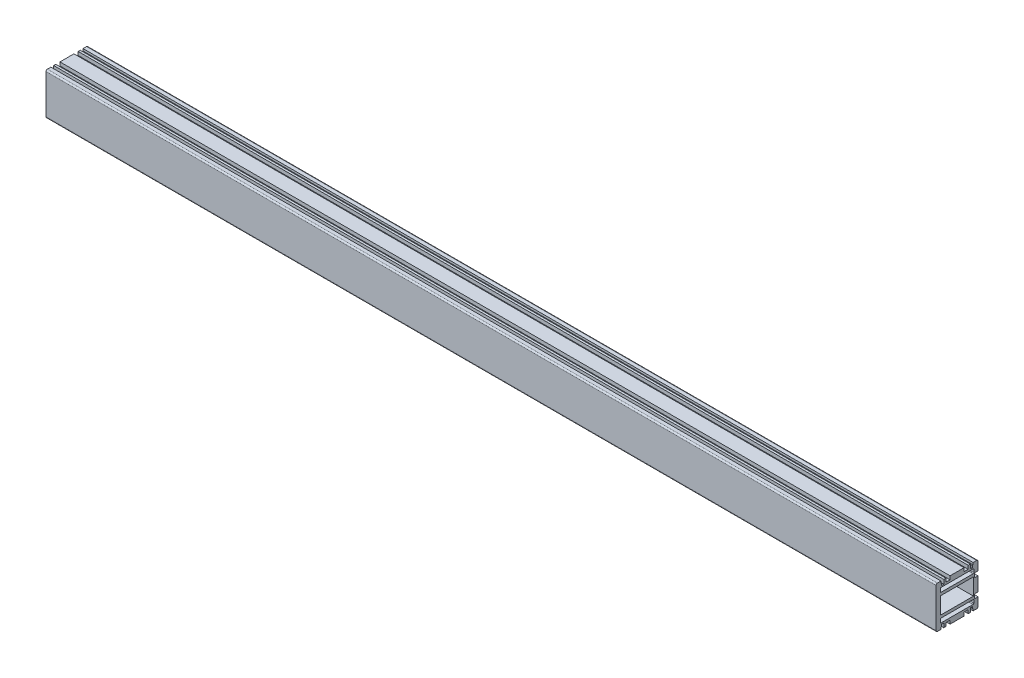
from build123d import *

# Parameters (mm, degrees)
SKETCH_1_W             = 23.5
SKETCH_1_H             = 12
EXTRUDE_1_DEPTH        = 318.5
HOLE_WIZARD_M6_1_D     = 5
HOLE_WIZARD_M6_1_DEPTH = 15
HOLE_WIZARD_M6_1_TIP   = 1.502151548
HOLE_WIZARD_M6_2_D     = 5
HOLE_WIZARD_M6_2_DEPTH = 15
HOLE_WIZARD_M6_2_TIP   = 1.502151548
HOLE_WIZARD_M4_1_D     = 3.3
HOLE_WIZARD_M4_1_DEPTH = 10.1
HOLE_WIZARD_M4_1_TIP   = 0.991420021


with BuildPart() as part:
    # 草图1 → 凸台-拉伸1 (new, symmetric)
    with BuildSketch(Plane(origin=(0, 0, 0), x_dir=(0, 0, -1), z_dir=(1, 0, 0))):
        with BuildLine():
            Line((-14, 15), (-11.5, 15))
            Line((-11.5, 15), (-11.5, 13.5))
            Line((-11.5, 13.5), (-11.4, 13.5))
            ThreePointArc((-11.4, 13.5), (-11.117157288, 13.382842712), (-11, 13.1))
            Line((-11, 13.1), (-11, 12))
            Line((-11, 12), (-9.5, 12))
            Line((-9.5, 12), (-9.5, 15))
            Line((-9.5, 15), (-8, 15))
            Line((-8, 15), (-8, 12.5))
            Line((-8, 12.5), (-5, 12.5))
            Line((-5, 12.5), (-5, 15))
            Line((-5, 15), (5, 15))
            Line((5, 15), (5, 12.5))
            Line((5, 12.5), (8, 12.5))
            Line((8, 12.5), (8, 15))
            Line((8, 15), (9.5, 15))
            Line((9.5, 15), (9.5, 12))
            Line((9.5, 12), (11, 12))
            Line((11, 12), (11, 13.1))
            ThreePointArc((11, 13.1), (11.117157288, 13.382842712), (11.4, 13.5))
            Line((11.4, 13.5), (11.5, 13.5))
            Line((11.5, 13.5), (11.5, 15))
            Line((11.5, 15), (14, 15))
            ThreePointArc((14, 15), (14.707106781, 14.707106781), (15, 14))
            Line((15, 14), (15, 8))
            Line((15, 8), (12.5, 8))
            Line((12.5, 8), (12.5, 5))
            Line((12.5, 5), (15, 5))
            Line((15, 5), (15, -5))
            Line((15, -5), (12.5, -5))
            Line((12.5, -5), (12.5, -8))
            Line((12.5, -8), (15, -8))
            Line((15, -8), (15, -14))
            ThreePointArc((15, -14), (14.707106781, -14.707106781), (14, -15))
            Line((14, -15), (11.5, -15))
            Line((11.5, -15), (11.5, -13.5))
            Line((11.5, -13.5), (11.4, -13.5))
            ThreePointArc((11.4, -13.5), (11.117157288, -13.382842712), (11, -13.1))
            Line((11, -13.1), (11, -12))
            Line((11, -12), (9.5, -12))
            Line((9.5, -12), (9.5, -15))
            Line((9.5, -15), (8, -15))
            Line((8, -15), (8, -12.5))
            Line((8, -12.5), (5, -12.5))
            Line((5, -12.5), (5, -15))
            Line((5, -15), (-5, -15))
            Line((-5, -15), (-5, -12.5))
            Line((-5, -12.5), (-8, -12.5))
            Line((-8, -12.5), (-8, -15))
            Line((-8, -15), (-9.5, -15))
            Line((-9.5, -15), (-9.5, -12))
            Line((-9.5, -12), (-11, -12))
            Line((-11, -12), (-11, -13.1))
            ThreePointArc((-11, -13.1), (-11.117157288, -13.382842712), (-11.4, -13.5))
            Line((-11.4, -13.5), (-11.5, -13.5))
            Line((-11.5, -13.5), (-11.5, -15))
            Line((-11.5, -15), (-14, -15))
            ThreePointArc((-14, -15), (-14.707106781, -14.707106781), (-15, -14))
            Line((-15, -14), (-15, 14))
            ThreePointArc((-15, 14), (-14.707106781, 14.707106781), (-14, 15))
        make_face()
        with BuildLine():
            Line((12, -10.5), (12, -8.5))
            ThreePointArc((12, -8.5), (11.853553391, -8.146446609), (11.5, -8))
            Line((11.5, -8), (-11.5, -8))
            ThreePointArc((-11.5, -8), (-11.853553391, -8.146446609), (-12, -8.5))
            Line((-12, -8.5), (-12, -10.5))
            ThreePointArc((-12, -10.5), (-11.853553391, -10.853553391), (-11.5, -11))
            Line((-11.5, -11), (11.5, -11))
            ThreePointArc((11.5, -11), (11.853553391, -10.853553391), (12, -10.5))
        make_face(mode=Mode.SUBTRACT)
        with BuildLine():
            Line((-11.5, 11), (11.5, 11))
            ThreePointArc((11.5, 11), (11.853553391, 10.853553391), (12, 10.5))
            Line((12, 10.5), (12, 8.5))
            ThreePointArc((12, 8.5), (11.853553391, 8.146446609), (11.5, 8))
            Line((11.5, 8), (-11.5, 8))
            ThreePointArc((-11.5, 8), (-11.853553391, 8.146446609), (-12, 8.5))
            Line((-12, 8.5), (-12, 10.5))
            ThreePointArc((-12, 10.5), (-11.853553391, 10.853553391), (-11.5, 11))
        make_face(mode=Mode.SUBTRACT)
        Rectangle(SKETCH_1_W, SKETCH_1_H, mode=Mode.SUBTRACT)
    extrude(amount=EXTRUDE_1_DEPTH, both=True)

    # M6 螺纹孔1
    with Locations(Plane(origin=(0, 0, -15), x_dir=(-1, 0, 0), z_dir=(0, 0, -1))):
        with Locations((298.5, -0.143680977), (283.5, 0)):
            Hole(HOLE_WIZARD_M6_1_D / 2, depth=HOLE_WIZARD_M6_1_DEPTH)
            with Locations((0, 0, -(HOLE_WIZARD_M6_1_DEPTH + HOLE_WIZARD_M6_1_TIP / 2))):  # 118° drill point
                Cone(0, HOLE_WIZARD_M6_1_D / 2, HOLE_WIZARD_M6_1_TIP, mode=Mode.SUBTRACT)

    # M6 螺纹孔2
    with Locations(Plane.XZ.offset(15)):
        with Locations((-298.5, 0), (-283.5, 0), (283.5, 0), (298.5, 0)):
            Hole(HOLE_WIZARD_M6_2_D / 2, depth=HOLE_WIZARD_M6_2_DEPTH)
            with Locations((0, 0, -(HOLE_WIZARD_M6_2_DEPTH + HOLE_WIZARD_M6_2_TIP / 2))):  # 118° drill point
                Cone(0, HOLE_WIZARD_M6_2_D / 2, HOLE_WIZARD_M6_2_TIP, mode=Mode.SUBTRACT)

    # M4 螺纹孔1
    with Locations(Plane(origin=(0, 0, -15), x_dir=(-1, 0, 0), z_dir=(0, 0, -1))):
        with Locations((-303.5, 0), (-118.5, 0), (66.5, 0), (251.5, 0)):
            Hole(HOLE_WIZARD_M4_1_D / 2, depth=HOLE_WIZARD_M4_1_DEPTH)
            with Locations((0, 0, -(HOLE_WIZARD_M4_1_DEPTH + HOLE_WIZARD_M4_1_TIP / 2))):  # 118° drill point
                Cone(0, HOLE_WIZARD_M4_1_D / 2, HOLE_WIZARD_M4_1_TIP, mode=Mode.SUBTRACT)


solid = part.part
